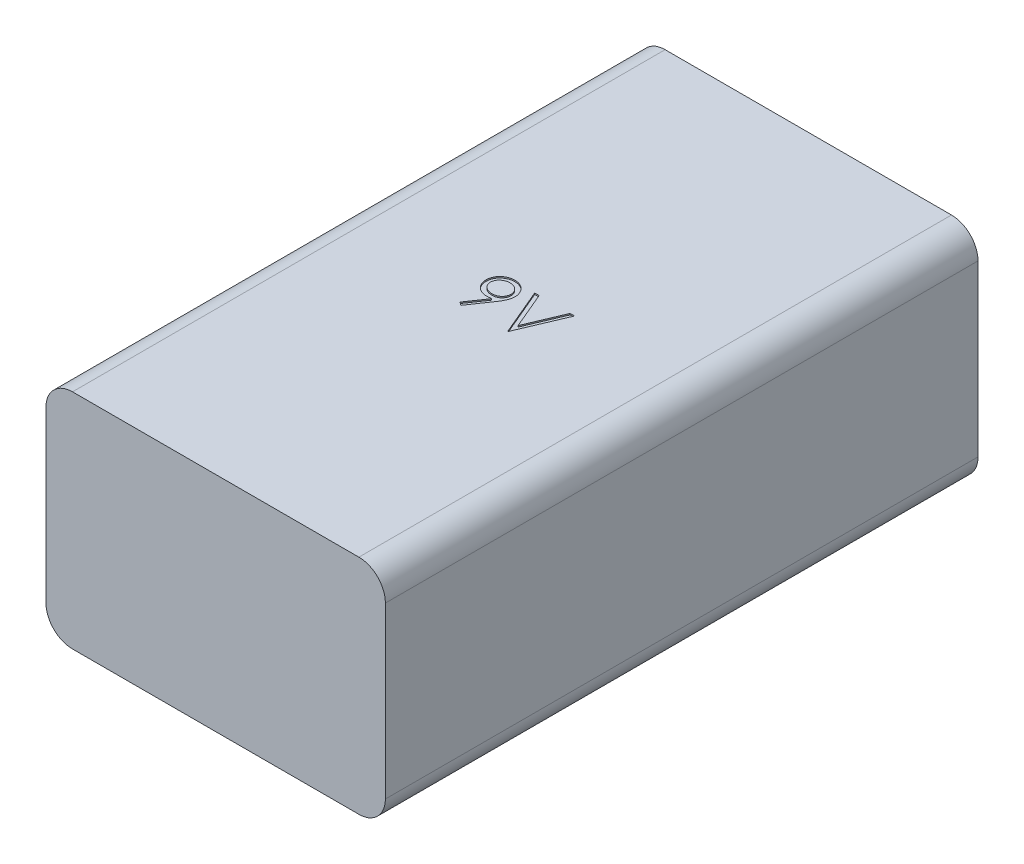
from build123d import *

# Parameters (mm, degrees)
SKETCH1_W           = 25.6
SKETCH1_H           = 44.7
BOSS_EXTRUDE1_DEPTH = 16.8
FILLET1_R           = 2
BOSS_EXTRUDE2_START = -44.7
SKETCH2_R           = 2.75
BOSS_EXTRUDE2_DEPTH = 47.3
CUT_EXTRUDE1_DEPTH  = 0.1


with BuildPart() as part:
    # Sketch1 → Boss-Extrude1 (new body)
    with BuildSketch(Plane(origin=(0, 0, 0), x_dir=(1, 0, 0), z_dir=(0, 1, 0))):
        with Locations((-11.517488789, 20.134753363)):
            Rectangle(SKETCH1_W, SKETCH1_H)
    extrude(amount=BOSS_EXTRUDE1_DEPTH)

    # Fillet1
    fillet1_edges = [part.edges().sort_by_distance(p)[0] for p in [
        (1.282511211, 16.8, -20.134753363),
        (-24.317488789, 16.8, -20.134753363),
        (1.282511211, 0, -20.134753363),
        (-24.317488789, 0, -20.134753363),
    ]]
    fillet(fillet1_edges, radius=FILLET1_R)

    # Sketch2 → Boss-Extrude2 (add)
    with BuildSketch(Plane(origin=(0, 0, -42.484753363), x_dir=(-1, 0, 0), z_dir=(0, 0, -1)).offset(BOSS_EXTRUDE2_START)):
        with Locations((17.767488789, 8.4)):
            Circle(SKETCH2_R)
        Polygon((5.067488789, 12.730127019), (1.317488789, 10.565063509), (1.317488789, 6.234936491), (5.067488789, 4.069872981), (8.817488789, 6.234936491), (8.817488789, 10.565063509), align=None)
    extrude(amount=BOSS_EXTRUDE2_DEPTH)

    # Sketch3 → Cut-Extrude1 (cut)
    # profile 1 of 2: a face of its own
    with BuildSketch(Plane(origin=(0, 16.8, 0), x_dir=(1, 0, 0), z_dir=(0, 1, 0))):
        with BuildLine():
            Line((-13.318041778, 18.082325539), (-13.569043381, 18.256904866))
            Line((-13.569043381, 18.256904866), (-12.595886329, 19.679480988))
            add(Edge.make_bspline(
                [(-12.595886329, 19.679480988), (-12.657977065, 19.671887924), (-12.780237185, 19.656936759), (-12.903374287, 19.654190105), (-12.963975272, 19.652838359)],
                knots=[0, 0, 0, 0, 1.015715272, 2, 2, 2, 2], degree=3))
            add(Edge.make_bspline(
                [(-12.963975272, 19.652838359), (-13.00071732, 19.653779436), (-13.072838746, 19.655626687), (-13.178870399, 19.670268495), (-13.280755959, 19.692818623), (-13.378225315, 19.726467378), (-13.47164482, 19.768285587), (-13.560810534, 19.8201426), (-13.645602424, 19.881148892), (-13.725109834, 19.950981884), (-13.797421573, 20.027659936), (-13.861844871, 20.108815579), (-13.915386003, 20.19539155), (-13.959862588, 20.285621769), (-13.993593042, 20.38080312), (-14.018155579, 20.47985252), (-14.033277934, 20.583464162), (-14.035077029, 20.653989293), (-14.035990496, 20.689797494)],
                knots=[0, 0, 0, 0, 1.060718605, 2.082097864, 3.085795603, 4.069760067, 5.054557537, 6.03741023, 7.043284206, 8.066802108, 9.088538119, 10.083643548, 11.053783639, 12.022749082, 12.983451788, 13.964007469, 14.966251758, 16, 16, 16, 16], degree=3))
            add(Edge.make_bspline(
                [(-14.035990496, 20.689797494), (-14.034256061, 20.738766147), (-14.030851718, 20.834881678), (-14.0034532, 20.975315447), (-13.958392861, 21.108101991), (-13.895564484, 21.232892185), (-13.816429763, 21.347890924), (-13.721321173, 21.451499533), (-13.610817209, 21.542244387), (-13.487435189, 21.620248464), (-13.354082169, 21.682983462), (-13.214413511, 21.729222762), (-13.069499391, 21.75642151), (-12.97133172, 21.760007371), (-12.921907964, 21.761812718)],
                knots=[0, 0, 0, 0, 1.022988612, 2.007919123, 2.978103895, 3.94594894, 4.918897164, 5.887013414, 6.875921846, 7.89917871, 8.930658928, 9.948724884, 10.967259574, 12, 12, 12, 12], degree=3))
            add(Edge.make_bspline(
                [(-12.921907964, 21.761812718), (-12.873419544, 21.759982555), (-12.777610998, 21.756366326), (-12.636721991, 21.729882357), (-12.501780974, 21.685245684), (-12.373535987, 21.62356112), (-12.254796575, 21.546240212), (-12.148020764, 21.454105689), (-12.055645225, 21.347100161), (-11.977821344, 21.227811671), (-11.915351304, 21.09964469), (-11.870279021, 20.965860768), (-11.842533382, 20.827422046), (-11.839037055, 20.733627572), (-11.837272547, 20.686291885)],
                knots=[0, 0, 0, 0, 1.026385292, 2.028040595, 3.023318987, 4.028184125, 5.03290303, 6.015178782, 7.004435299, 8.016004309, 9.023023918, 10.015172535, 10.998308025, 12, 12, 12, 12], degree=3))
            add(Edge.make_bspline(
                [(-11.837272547, 20.686291885), (-11.838450956, 20.649548118), (-11.840841064, 20.575022577), (-11.857577371, 20.461792234), (-11.885997556, 20.346341005), (-11.918249255, 20.248619409), (-11.949381423, 20.167910959), (-11.978682554, 20.104159379), (-12.011194708, 20.037058116), (-12.049113473, 19.967310778), (-12.08987577, 19.894028243), (-12.135935047, 19.817945527), (-12.186240619, 19.738960534), (-12.222070338, 19.685713446), (-12.240417579, 19.658447334)],
                knots=[0, 0, 0, 0, 1.179839688, 2.393009684, 3.667231171, 4.993948276, 5.694988576, 6.444077775, 7.246288328, 8.089075292, 8.993003841, 9.939041771, 10.944649915, 12, 12, 12, 12], degree=3))
            Line((-12.240417579, 19.658447334), (-13.318041778, 18.082325539))
        make_face()
        with BuildLine():
            add(Edge.make_bspline(
                [(-12.905782163, 20.011812718), (-12.877948149, 20.012573102), (-12.823764786, 20.014053311), (-12.744387487, 20.023062553), (-12.669463283, 20.039036539), (-12.598792034, 20.061956251), (-12.531665132, 20.08961292), (-12.469148804, 20.124824906), (-12.411190728, 20.166841541), (-12.357402801, 20.214051556), (-12.309638802, 20.26650214), (-12.267095771, 20.321399247), (-12.230935204, 20.378983857), (-12.202371926, 20.439977119), (-12.178887351, 20.502894327), (-12.162669339, 20.568748683), (-12.153685006, 20.637197083), (-12.152153431, 20.683695741), (-12.151375111, 20.707325539)],
                knots=[0, 0, 0, 0, 1.163407946, 2.26475976, 3.333800367, 4.359385343, 5.366239384, 6.363380779, 7.350133999, 8.353570782, 9.349036268, 10.310270964, 11.253520213, 12.184142, 13.120487599, 14.056272588, 15.012232024, 16, 16, 16, 16], degree=3))
            add(Edge.make_bspline(
                [(-12.151375111, 20.707325539), (-12.152044781, 20.730965204), (-12.153364446, 20.777550064), (-12.163951746, 20.846099804), (-12.182576969, 20.911793065), (-12.207567453, 20.974989495), (-12.240487691, 21.035169867), (-12.279991177, 21.093089738), (-12.326923627, 21.148381866), (-12.380926193, 21.19974585), (-12.439160746, 21.247093749), (-12.501221246, 21.288879825), (-12.566596162, 21.323901021), (-12.634886652, 21.352799991), (-12.706235001, 21.375351767), (-12.780598989, 21.391569132), (-12.858354395, 21.400540886), (-12.911135681, 21.402062781), (-12.938033765, 21.402838359)],
                knots=[0, 0, 0, 0, 0.972161553, 1.915763587, 2.844109794, 3.775983486, 4.705125789, 5.659731448, 6.655561913, 7.682237399, 8.721216875, 9.739758359, 10.754845918, 11.767244016, 12.7857855, 13.828538656, 14.893392813, 16, 16, 16, 16], degree=3))
            add(Edge.make_bspline(
                [(-12.938033765, 21.402838359), (-12.964697919, 21.402061528), (-13.017012768, 21.40053739), (-13.094076927, 21.391586185), (-13.167938095, 21.375242701), (-13.239079716, 21.352810437), (-13.307368176, 21.323898866), (-13.372740009, 21.28887799), (-13.434815026, 21.247103368), (-13.492993746, 21.199708595), (-13.547091668, 21.148620949), (-13.593217197, 21.09284752), (-13.63281109, 21.035199996), (-13.665686092, 20.974981487), (-13.69068861, 20.911795202), (-13.709310611, 20.846099225), (-13.719898776, 20.777550215), (-13.721218323, 20.730965255), (-13.721887932, 20.707325539)],
                knots=[0, 0, 0, 0, 1.099389452, 2.15699305, 3.192601482, 4.213358962, 5.227959689, 6.245255729, 7.266013209, 8.307253147, 9.336162325, 10.327954924, 11.284637477, 12.215801273, 13.149702402, 14.080068371, 15.025723358, 16, 16, 16, 16], degree=3))
            add(Edge.make_bspline(
                [(-13.721887932, 20.707325539), (-13.721282006, 20.68367734), (-13.720087009, 20.637038764), (-13.708559219, 20.568512371), (-13.689280939, 20.502824177), (-13.663461549, 20.43933547), (-13.629459958, 20.378663612), (-13.58773611, 20.32109625), (-13.538830564, 20.2659808), (-13.483397077, 20.214173588), (-13.422728916, 20.166621412), (-13.35793217, 20.12509103), (-13.290122333, 20.090018586), (-13.219060702, 20.061877202), (-13.145273902, 20.039265539), (-13.068098771, 20.023091993), (-12.987790533, 20.014139727), (-12.933380551, 20.01259583), (-12.905782163, 20.011812718)],
                knots=[0, 0, 0, 0, 0.952633368, 1.87876736, 2.791047057, 3.707742249, 4.635551637, 5.587206343, 6.568248508, 7.601284464, 8.641511608, 9.671105535, 10.699146789, 11.713763218, 12.747829548, 13.806491675, 14.887386225, 16, 16, 16, 16], degree=3))
        make_face(mode=Mode.SUBTRACT)
    # profile 2 of 2: a face of its own
    with BuildSketch(Plane(origin=(0, 16.8, 0), x_dir=(1, 0, 0), z_dir=(0, 1, 0))):
        Polygon((-11.343682804, 21.672069129), (-11.007144342, 21.672069129), (-9.840477676, 18.913855988), (-8.673811009, 21.672069129), (-8.337272547, 21.672069129), (-9.818041778, 18.172069129), (-9.862913573, 18.172069129), align=None)
    extrude(amount=-CUT_EXTRUDE1_DEPTH, mode=Mode.SUBTRACT)


solid = part.part
